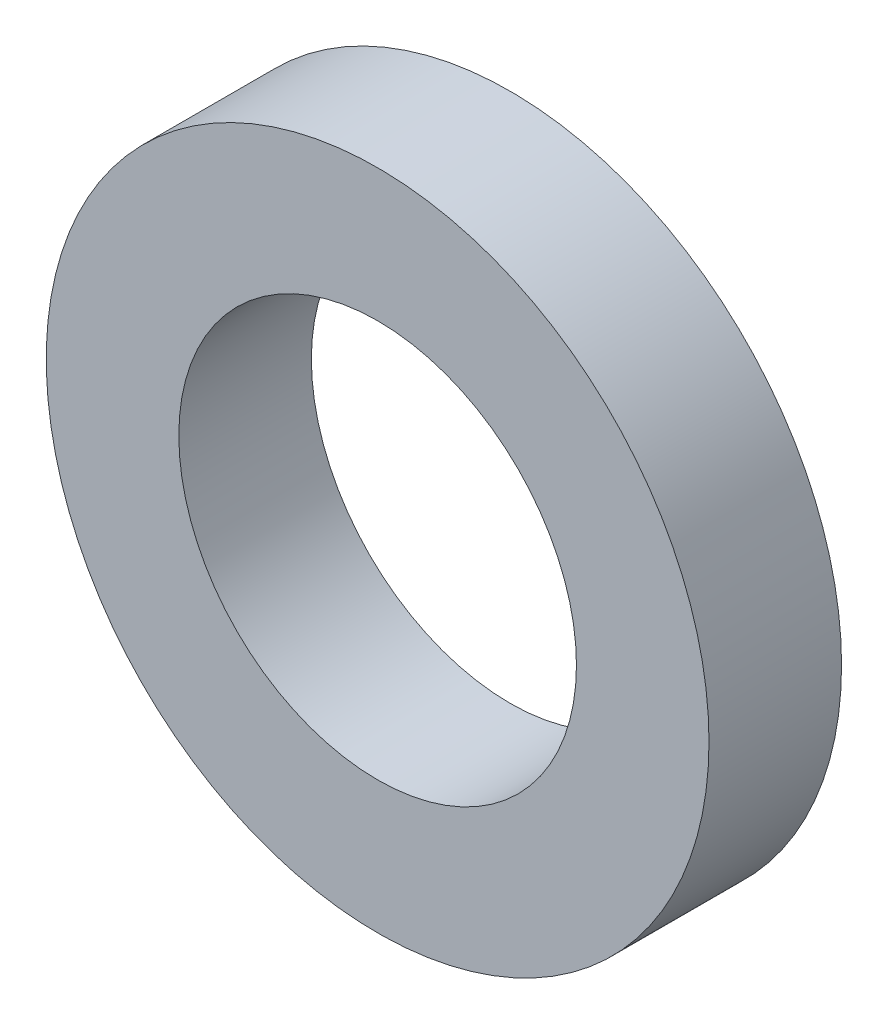
from build123d import *

# Parameters (mm, degrees)
SKETCH1_R           = 25
SKETCH1_R_2         = 15
BOSS_EXTRUDE1_DEPTH = 10


with BuildPart() as part:
    # Sketch1 → Boss-Extrude1 (new body)
    with BuildSketch(Plane.XY):
        Circle(SKETCH1_R)
        Circle(SKETCH1_R_2, mode=Mode.SUBTRACT)
    extrude(amount=BOSS_EXTRUDE1_DEPTH)


solid = part.part
